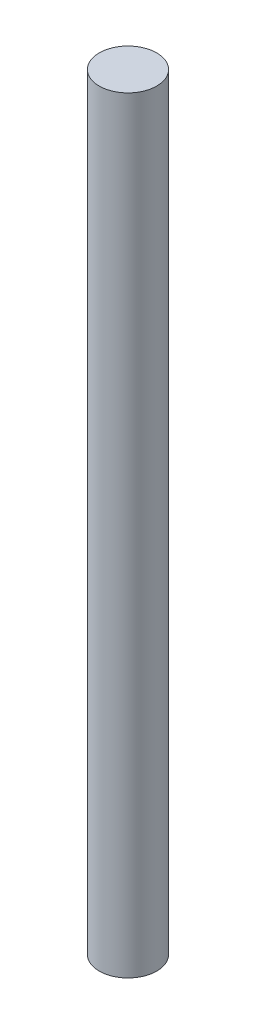
from build123d import *

# Parameters (mm, degrees)
SKETCH1_R           = 1.5
BOSS_EXTRUDE1_DEPTH = 40


with BuildPart() as part:
    # Sketch1 → Boss-Extrude1 (new body)
    with BuildSketch(Plane(origin=(0, 0, 0), x_dir=(1, 0, 0), z_dir=(0, 1, 0))):
        with Locations(Location((0, 1.439933594, 0), (0, 0, 270))):
            Circle(SKETCH1_R)
    extrude(amount=BOSS_EXTRUDE1_DEPTH)


solid = part.part
